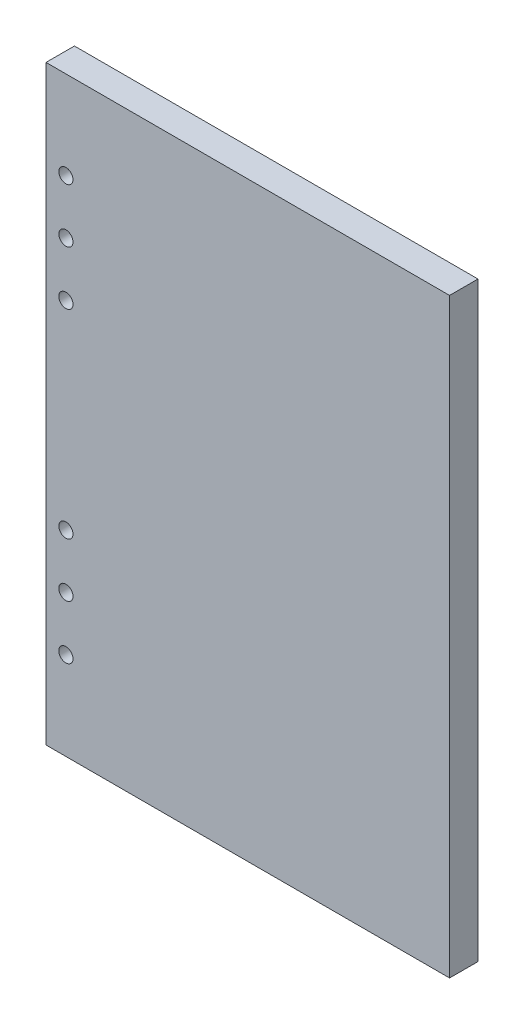
from build123d import *

# Parameters (mm, degrees)
SKETCH_1_W      = 142
SKETCH_1_H      = 208
SKETCH_1_R      = 2.5
EXTRUDE_1_DEPTH = 10


with BuildPart() as part:
    # Эскиз1 → Бобышка-Вытянуть1 (new body)
    with BuildSketch(Plane.XY):
        with Locations((71, 104)):
            Rectangle(SKETCH_1_W, SKETCH_1_H)
        with Locations((7, 139)):
            Circle(SKETCH_1_R, mode=Mode.SUBTRACT)
        with Locations((7, 158)):
            Circle(SKETCH_1_R, mode=Mode.SUBTRACT)
        with Locations((7, 177)):
            Circle(SKETCH_1_R, mode=Mode.SUBTRACT)
        with Locations(Location((7, 31, 0), (0, 0, 180))):
            Circle(SKETCH_1_R, mode=Mode.SUBTRACT)
        with Locations(Location((7, 50, 0), (0, 0, 180))):
            Circle(SKETCH_1_R, mode=Mode.SUBTRACT)
        with Locations(Location((7, 69, 0), (0, 0, 180))):
            Circle(SKETCH_1_R, mode=Mode.SUBTRACT)
    extrude(amount=EXTRUDE_1_DEPTH)


solid = part.part
